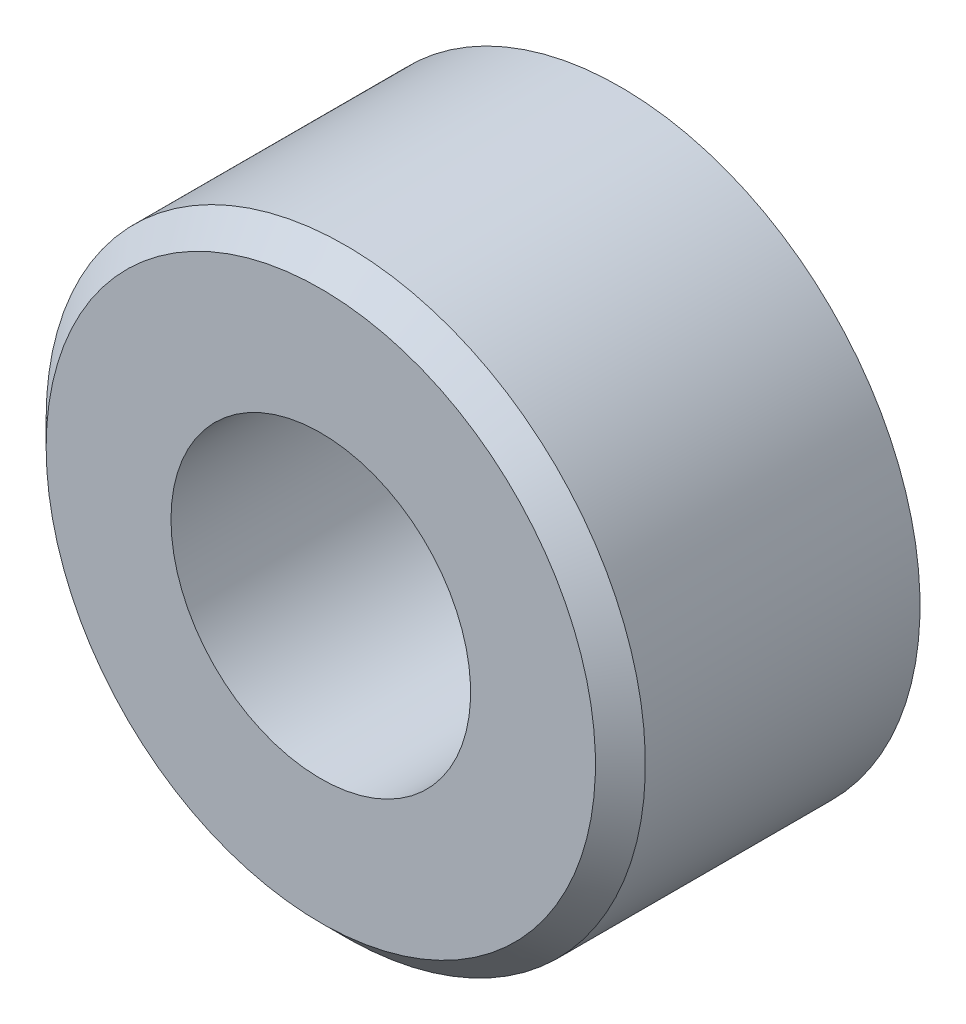
from build123d import *


with BuildPart() as part:
    # Sketch1 → Revolve1 (revolve)
    with BuildSketch(Plane.XZ, mode=Mode.PRIVATE) as revolve1_sk:
        Polygon((3, 6), (3, 0), (6, 0), (6, 5.5), (5.5, 6), align=None)
    revolve(revolve1_sk.sketch.rotate(Axis((0, 0, 6), (0, 0, -1)), 180), axis=Axis((0, 0, 6), (0, 0, -1)))


solid = part.part
